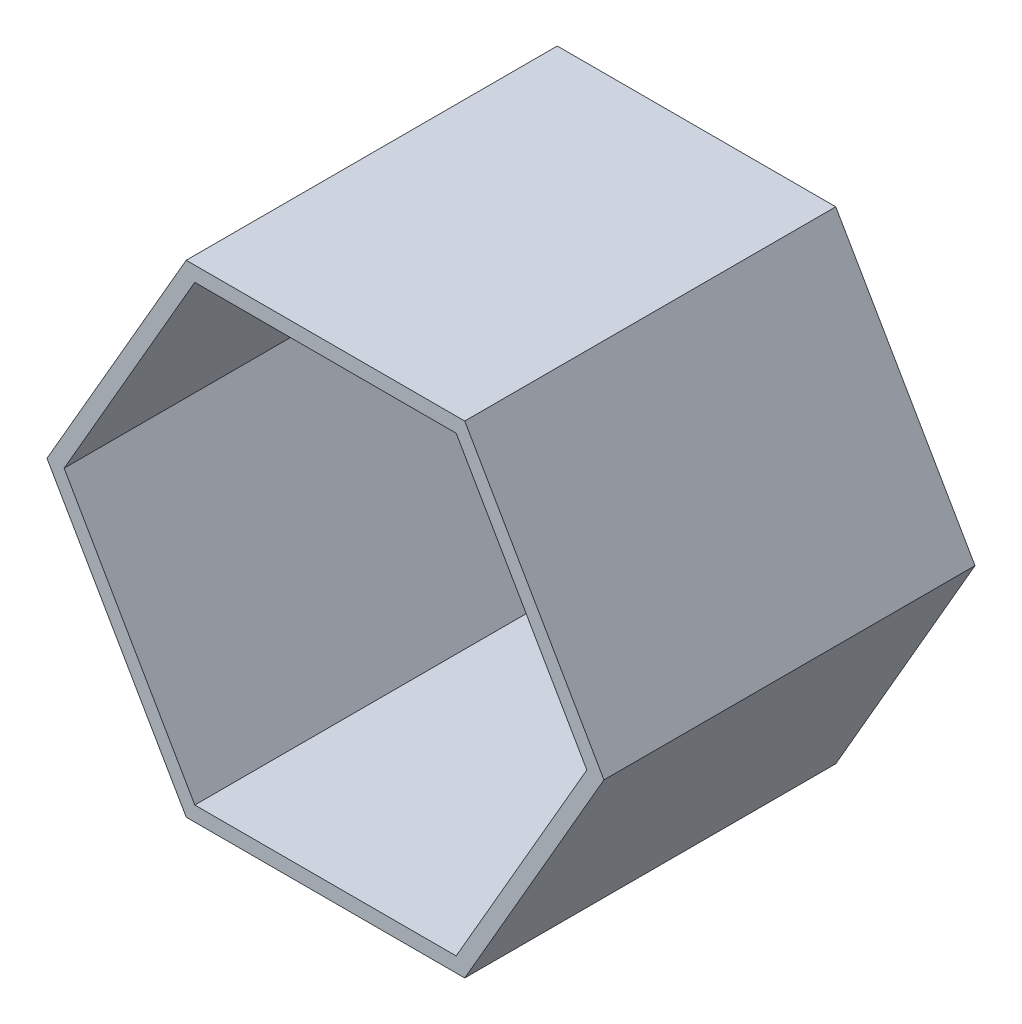
from build123d import *

# Parameters (mm, degrees)
SALIENTE_EXTRUIR1_DEPTH = 15


with BuildPart() as part:
    # Croquis1 → Saliente-Extruir1 (new body)
    with BuildSketch(Plane.XY):
        Polygon((-19.795384964, 11.700146519), (-25.424550089, 21.450146519), (-36.682880338, 21.450146519), (-42.312045463, 11.700146519), (-36.682880338, 1.950146519), (-25.424550089, 1.950146519), align=None)
        Polygon((-20.488205287, 11.700146519), (-25.77096025, 20.850146519), (-36.336470177, 20.850146519), (-41.61922514, 11.700146519), (-36.336470177, 2.550146519), (-25.77096025, 2.550146519), align=None, mode=Mode.SUBTRACT)
    extrude(amount=SALIENTE_EXTRUIR1_DEPTH)


solid = part.part
